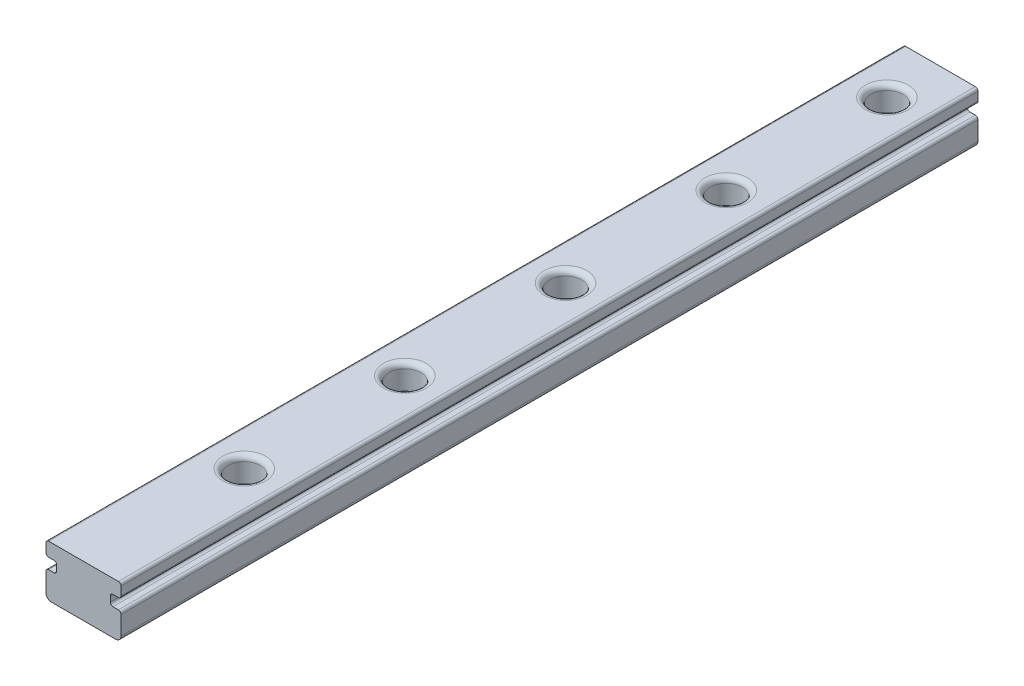
from build123d import *

# Parameters (mm, degrees)
EXTRUDE_1_DEPTH                = 80
FILLET_1_R                     = 0.25
FILLET_2_R                     = 0.5
SKETCH_2_R                     = 1.5
CUT_EXTRUDE_1_DEPTH            = 2.3
SKETCH_3_R                     = 1.2
CUT_EXTRUDE_2_DEPTH            = 81.344570445
FILLET_3_R                     = 0.5
PATTERN_LINEAR_2_COUNT         = 5
PATTERN_LINEAR_2_PITCH         = 15
FILLET_3_OF_PATTERN_LINEAR_2_R = 0.5


with BuildPart() as part:
    # 草图1 → 凸台-拉伸1 (new body)
    with BuildSketch(Plane.XY):
        Polygon((7, 2.5), (7, 0), (0, 0), (0, 2.5), (1, 2.5), (1, 3.5), (0, 3.5), (0, 4.8), (7, 4.8), (7, 3.5), (6, 3.5), (6, 2.5), align=None)
    extrude(amount=EXTRUDE_1_DEPTH)

    # 圆角1
    fillet_1_edges = [part.edges().sort_by_distance(p)[0] for p in [
        (0, 2.5, 40),
        (1, 2.5, 40),
        (1, 3.5, 40),
        (0, 3.5, 40),
        (0, 4.8, 40),
        (7, 4.8, 40),
        (7, 3.5, 40),
        (6, 3.5, 40),
        (6, 2.5, 40),
        (7, 2.5, 40),
    ]]
    fillet(fillet_1_edges, radius=FILLET_1_R)

    # 圆角2
    fillet_2_edges = [part.edges().sort_by_distance(p)[0] for p in [
        (7, 0, 40),
        (0, 0, 40),
    ]]
    fillet(fillet_2_edges, radius=FILLET_2_R)

    # 草图2 → 切除-拉伸1 (cut)
    with BuildSketch(Plane(origin=(0, 4.8, 0), x_dir=(1, 0, 0), z_dir=(0, 1, 0))):
        with Locations(Location((3.5, -5, 0), (0, 0, 270))):
            Circle(SKETCH_2_R)
    cut_extrude_1 = extrude(amount=-CUT_EXTRUDE_1_DEPTH, mode=Mode.SUBTRACT)

    # 草图3 → 切除-拉伸2 (cut, through all)
    with BuildSketch(Plane(origin=(0, 2.5, 0), x_dir=(1, 0, 0), z_dir=(0, 1, 0))):
        with Locations(Location((3.5, -5, 0), (0, 0, 270))):
            Circle(SKETCH_3_R)
    cut_extrude_2 = extrude(amount=-CUT_EXTRUDE_2_DEPTH, mode=Mode.SUBTRACT)

    # 圆角3
    fillet_3_edges = [part.edges().sort_by_distance(p)[0] for p in [
        (3.5, 4.8, 3.5),
    ]]
    fillet(fillet_3_edges, radius=FILLET_3_R)

    # 阵列(线性)2: 切除-拉伸1, 切除-拉伸2 ×5
    with Locations(*[(0, 0, i * PATTERN_LINEAR_2_PITCH) for i in range(1, PATTERN_LINEAR_2_COUNT)]):
        add(cut_extrude_1, mode=Mode.SUBTRACT)
        add(cut_extrude_2, mode=Mode.SUBTRACT)

    # 圆角3 of 阵列(线性)2
    fillet_3_of_pattern_linear_2_edges = [part.edges().sort_by_distance(p)[0] for p in [
        (3.5, 4.8, 18.5),
        (3.5, 4.8, 33.5),
        (3.5, 4.8, 48.5),
        (3.5, 4.8, 63.5),
    ]]
    fillet(fillet_3_of_pattern_linear_2_edges, radius=FILLET_3_OF_PATTERN_LINEAR_2_R)


solid = part.part
